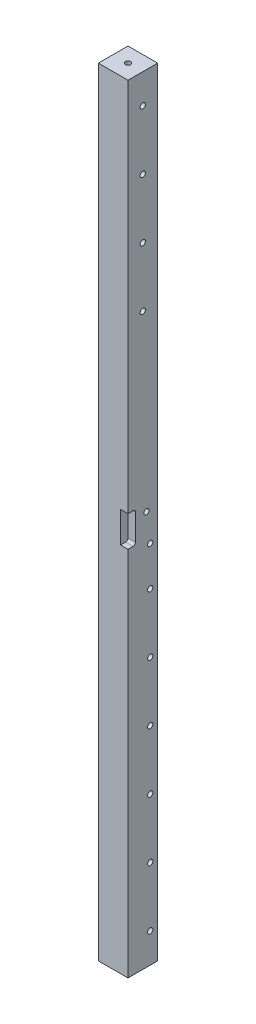
from build123d import *

# Parameters (mm, degrees)
SKETCH1_W                           = 12.7
SKETCH1_H                           = 12.7
BOSS_EXTRUDE1_DEPTH                 = 333.2
F_4_40_TAPPED_HOLE1_D               = 2.2606
F_4_40_TAPPED_HOLE1_DEPTH           = 8.885
F_4_40_TAPPED_HOLE1_TIP             = 0.679152758
F_4_40_TAPPED_HOLE1_ON_FACE_2_D     = 2.2606
F_4_40_TAPPED_HOLE1_ON_FACE_2_DEPTH = 8.885
F_4_40_TAPPED_HOLE1_ON_FACE_2_TIP   = 0.679152758
LPATTERN1_COUNT                     = 7
LPATTERN1_PITCH                     = 25.4
CIRPATTERN2_COUNT                   = 2
CIRPATTERN2_ANGLE                   = 90
SKETCH4_W                           = 15
SKETCH4_H                           = 13.2
CUT_EXTRUDE1_DEPTH                  = 3.175
CIRPATTERN3_COUNT                   = 3
CIRPATTERN3_ANGLE                   = 180
LPATTERN2_COUNT                     = 6
LPATTERN2_PITCH                     = 25.4
CIRPATTERN4_COUNT                   = 4
FILLET1_R                           = 1
F_4_40_TAPPED_HOLE5_D               = 2.2606
F_4_40_TAPPED_HOLE5_DEPTH           = 7.5
F_4_40_TAPPED_HOLE5_TIP             = 0.679152758
F_4_40_TAPPED_HOLE5_ON_FACE_2_D     = 2.2606
F_4_40_TAPPED_HOLE5_ON_FACE_2_DEPTH = 7.5
F_4_40_TAPPED_HOLE5_ON_FACE_2_TIP   = 0.679152758
F_4_40_TAPPED_HOLE6_D               = 2.2606
F_4_40_TAPPED_HOLE6_DEPTH           = 7.5
F_4_40_TAPPED_HOLE6_TIP             = 0.679152758
F_4_40_TAPPED_HOLE6_ON_FACE_2_D     = 2.2606
F_4_40_TAPPED_HOLE6_ON_FACE_2_DEPTH = 7.5
F_4_40_TAPPED_HOLE6_ON_FACE_2_TIP   = 0.679152758


with BuildPart() as part:
    # Sketch1 → Boss-Extrude1 (new body)
    with BuildSketch(Plane(origin=(0, 0, 0), x_dir=(1, 0, 0), z_dir=(0, 1, 0))):
        with Locations((6.35, -6.35)):
            Rectangle(SKETCH1_W, SKETCH1_H)
    extrude(amount=BOSS_EXTRUDE1_DEPTH)

    # #4-40 Tapped Hole1
    with Locations(Plane(origin=(6.35, 333.2, 6.35), x_dir=(0, 0, 1), z_dir=(0, 1, 0))):
        with Locations((0, 0)):
            Hole(F_4_40_TAPPED_HOLE1_D / 2, depth=F_4_40_TAPPED_HOLE1_DEPTH)
            with Locations((0, 0, -(F_4_40_TAPPED_HOLE1_DEPTH + F_4_40_TAPPED_HOLE1_TIP / 2))):  # 118° drill point
                Cone(0, F_4_40_TAPPED_HOLE1_D / 2, F_4_40_TAPPED_HOLE1_TIP, mode=Mode.SUBTRACT)

    # #4-40 Tapped Hole1 on face 2
    with Locations(Plane(origin=(6.35, 0, 6.35), x_dir=(0, 0, -1), z_dir=(0, -1, 0))):
        with Locations((0, 0)):
            Hole(F_4_40_TAPPED_HOLE1_ON_FACE_2_D / 2, depth=F_4_40_TAPPED_HOLE1_ON_FACE_2_DEPTH)
            with Locations((0, 0, -(F_4_40_TAPPED_HOLE1_ON_FACE_2_DEPTH + F_4_40_TAPPED_HOLE1_ON_FACE_2_TIP / 2))):  # 118° drill point
                Cone(0, F_4_40_TAPPED_HOLE1_ON_FACE_2_D / 2, F_4_40_TAPPED_HOLE1_ON_FACE_2_TIP, mode=Mode.SUBTRACT)

    # Sketch3 → #4-40 Tapped Hole2 (revolve, cut)
    with BuildSketch(Plane(origin=(6.35, 320.5, 0), x_dir=(0, 1, 0), z_dir=(1, 0, 0))):
        Polygon((0, 0), (0, 8.179152758), (1.1303, 7.5), (1.1303, 0), align=None)
    f_4_40_tapped_hole2 = revolve(axis=Axis((6.35, 320.5, -6.35), (0, 0, 1)), mode=Mode.SUBTRACT)

    # LPattern1: #4-40 Tapped Hole2 ×7, 3 skipped
    with Locations(*[(0, -i * LPATTERN1_PITCH, 0) for i in range(1, LPATTERN1_COUNT) if i not in (4, 5, 6)]):
        add(f_4_40_tapped_hole2, mode=Mode.SUBTRACT)

    # CirPattern2: #4-40 Tapped Hole2 ×2 about axis
    cirpattern2_axis = Axis((6.35, 0, 6.35), (0, -1, 0))
    for i in range(1, CIRPATTERN2_COUNT):
        add(f_4_40_tapped_hole2.rotate(cirpattern2_axis, i * CIRPATTERN2_ANGLE / (CIRPATTERN2_COUNT - 1)), mode=Mode.SUBTRACT)

    # CirPattern2 copy 1 sketch → CirPattern2 copy 1 (revolve, cut)
    with BuildSketch(Plane(origin=(12.7, 295.1, 6.35), x_dir=(0, 1, 0), z_dir=(0, 0, 1))):
        Polygon((0, 0), (0, 8.179152758), (1.1303, 7.5), (1.1303, 0), align=None)
    revolve(axis=Axis((19.05, 295.1, 6.35), (-1, 0, 0)), mode=Mode.SUBTRACT)

    # CirPattern2 copy 2 sketch → CirPattern2 copy 2 (revolve, cut)
    with BuildSketch(Plane(origin=(12.7, 269.7, 6.35), x_dir=(0, 1, 0), z_dir=(0, 0, 1))):
        Polygon((0, 0), (0, 8.179152758), (1.1303, 7.5), (1.1303, 0), align=None)
    revolve(axis=Axis((19.05, 269.7, 6.35), (-1, 0, 0)), mode=Mode.SUBTRACT)

    # CirPattern2 copy 3 sketch → CirPattern2 copy 3 (revolve, cut)
    with BuildSketch(Plane(origin=(12.7, 244.3, 6.35), x_dir=(0, 1, 0), z_dir=(0, 0, 1))):
        Polygon((0, 0), (0, 8.179152758), (1.1303, 7.5), (1.1303, 0), align=None)
    revolve(axis=Axis((19.05, 244.3, 6.35), (-1, 0, 0)), mode=Mode.SUBTRACT)

    # Sketch4 → Cut-Extrude1 (cut)
    with BuildSketch(Plane(origin=(12.7, 0, 0), x_dir=(0, 0, -1), z_dir=(1, 0, 0))):
        with Locations((-17.025, 165.72)):
            Rectangle(SKETCH4_W, SKETCH4_H)
    cut_extrude1 = extrude(amount=-CUT_EXTRUDE1_DEPTH, mode=Mode.SUBTRACT)

    # CirPattern3: Cut-Extrude1 ×3 about axis, 1 skipped
    cirpattern3_axis = Axis((6.35, 333.2, 6.35), (0, 1, 0))
    add([cut_extrude1.rotate(cirpattern3_axis, i * CIRPATTERN3_ANGLE / (CIRPATTERN3_COUNT - 1)) for i in range(1, CIRPATTERN3_COUNT) if i not in (1,)], mode=Mode.SUBTRACT)

    # Sketch5 → #4-40 Tapped Hole3 (revolve, cut)
    with BuildSketch(Plane(origin=(12.7, 12.7, 3.175), x_dir=(0, 0, -1), z_dir=(0, 1, 0))):
        Polygon((0, 0), (0, 7.679152758), (1.1303, 7), (1.1303, 0), align=None)
    f_4_40_tapped_hole3 = revolve(axis=Axis((19.05, 12.7, 3.175), (-1, 0, 0)), mode=Mode.SUBTRACT)

    # LPattern2: #4-40 Tapped Hole3 ×6
    with Locations(*[(0, i * LPATTERN2_PITCH, 0) for i in range(1, LPATTERN2_COUNT)]):
        add(f_4_40_tapped_hole3, mode=Mode.SUBTRACT)

    # CirPattern4: #4-40 Tapped Hole3 ×4 about axis, 2 skipped
    cirpattern4_axis = Axis((6.35, 333.2, 6.35), (0, 1, 0))
    add([f_4_40_tapped_hole3.rotate(cirpattern4_axis, i * 360 / CIRPATTERN4_COUNT) for i in range(1, CIRPATTERN4_COUNT) if i not in (2, 3)], mode=Mode.SUBTRACT)

    # CirPattern4 copy 1 sketch → CirPattern4 copy 1 (revolve, cut)
    with BuildSketch(Plane(origin=(3.175, 38.1, 0), x_dir=(-1, 0, 0), z_dir=(0, 1, 0))):
        Polygon((0, 0), (0, 7.679152758), (1.1303, 7), (1.1303, 0), align=None)
    revolve(axis=Axis((3.175, 38.1, -6.35), (0, 0, 1)), mode=Mode.SUBTRACT)

    # CirPattern4 copy 2 sketch → CirPattern4 copy 2 (revolve, cut)
    with BuildSketch(Plane(origin=(3.175, 63.5, 0), x_dir=(-1, 0, 0), z_dir=(0, 1, 0))):
        Polygon((0, 0), (0, 7.679152758), (1.1303, 7), (1.1303, 0), align=None)
    revolve(axis=Axis((3.175, 63.5, -6.35), (0, 0, 1)), mode=Mode.SUBTRACT)

    # CirPattern4 copy 3 sketch → CirPattern4 copy 3 (revolve, cut)
    with BuildSketch(Plane(origin=(3.175, 88.9, 0), x_dir=(-1, 0, 0), z_dir=(0, 1, 0))):
        Polygon((0, 0), (0, 7.679152758), (1.1303, 7), (1.1303, 0), align=None)
    revolve(axis=Axis((3.175, 88.9, -6.35), (0, 0, 1)), mode=Mode.SUBTRACT)

    # CirPattern4 copy 4 sketch → CirPattern4 copy 4 (revolve, cut)
    with BuildSketch(Plane(origin=(3.175, 114.3, 0), x_dir=(-1, 0, 0), z_dir=(0, 1, 0))):
        Polygon((0, 0), (0, 7.679152758), (1.1303, 7), (1.1303, 0), align=None)
    revolve(axis=Axis((3.175, 114.3, -6.35), (0, 0, 1)), mode=Mode.SUBTRACT)

    # CirPattern4 copy 5 sketch → CirPattern4 copy 5 (revolve, cut)
    with BuildSketch(Plane(origin=(3.175, 139.7, 0), x_dir=(-1, 0, 0), z_dir=(0, 1, 0))):
        Polygon((0, 0), (0, 7.679152758), (1.1303, 7), (1.1303, 0), align=None)
    revolve(axis=Axis((3.175, 139.7, -6.35), (0, 0, 1)), mode=Mode.SUBTRACT)

    # Fillet1
    fillet1_edges = [part.edges().sort_by_distance(p)[0] for p in [
        (11.1125, 159.12, 9.525),
        (11.1125, 172.32, 9.525),
        (3.175, 172.32, 1.5875),
        (3.175, 159.12, 1.5875),
    ]]
    fillet(fillet1_edges, radius=FILLET1_R)

    # #4-40 Tapped Hole5
    with Locations(Plane(origin=(12.7, 169.07, 4.7625), x_dir=(0, 0, 1), z_dir=(1, 0, 0))):
        with Locations((0, 0)):
            Hole(F_4_40_TAPPED_HOLE5_D / 2, depth=F_4_40_TAPPED_HOLE5_DEPTH)
            with Locations((0, 0, -(F_4_40_TAPPED_HOLE5_DEPTH + F_4_40_TAPPED_HOLE5_TIP / 2))):  # 118° drill point
                Cone(0, F_4_40_TAPPED_HOLE5_D / 2, F_4_40_TAPPED_HOLE5_TIP, mode=Mode.SUBTRACT)

    # #4-40 Tapped Hole5 on face 2
    with Locations(Plane(origin=(7.9375, 169.07, 0), x_dir=(-1, 0, 0), z_dir=(0, 0, -1))):
        with Locations((0, 0)):
            Hole(F_4_40_TAPPED_HOLE5_ON_FACE_2_D / 2, depth=F_4_40_TAPPED_HOLE5_ON_FACE_2_DEPTH)
            with Locations((0, 0, -(F_4_40_TAPPED_HOLE5_ON_FACE_2_DEPTH + F_4_40_TAPPED_HOLE5_ON_FACE_2_TIP / 2))):  # 118° drill point
                Cone(0, F_4_40_TAPPED_HOLE5_ON_FACE_2_D / 2, F_4_40_TAPPED_HOLE5_ON_FACE_2_TIP, mode=Mode.SUBTRACT)

    # #4-40 Tapped Hole6
    with Locations(Plane(origin=(12.7, 156.5325, 3.175), x_dir=(0, 0, 1), z_dir=(1, 0, 0))):
        with Locations((0, 0)):
            Hole(F_4_40_TAPPED_HOLE6_D / 2, depth=F_4_40_TAPPED_HOLE6_DEPTH)
            with Locations((0, 0, -(F_4_40_TAPPED_HOLE6_DEPTH + F_4_40_TAPPED_HOLE6_TIP / 2))):  # 118° drill point
                Cone(0, F_4_40_TAPPED_HOLE6_D / 2, F_4_40_TAPPED_HOLE6_TIP, mode=Mode.SUBTRACT)

    # #4-40 Tapped Hole6 on face 2
    with Locations(Plane(origin=(3.175, 156.5325, 0), x_dir=(-1, 0, 0), z_dir=(0, 0, -1))):
        with Locations((0, 0)):
            Hole(F_4_40_TAPPED_HOLE6_ON_FACE_2_D / 2, depth=F_4_40_TAPPED_HOLE6_ON_FACE_2_DEPTH)
            with Locations((0, 0, -(F_4_40_TAPPED_HOLE6_ON_FACE_2_DEPTH + F_4_40_TAPPED_HOLE6_ON_FACE_2_TIP / 2))):  # 118° drill point
                Cone(0, F_4_40_TAPPED_HOLE6_ON_FACE_2_D / 2, F_4_40_TAPPED_HOLE6_ON_FACE_2_TIP, mode=Mode.SUBTRACT)


solid = part.part
